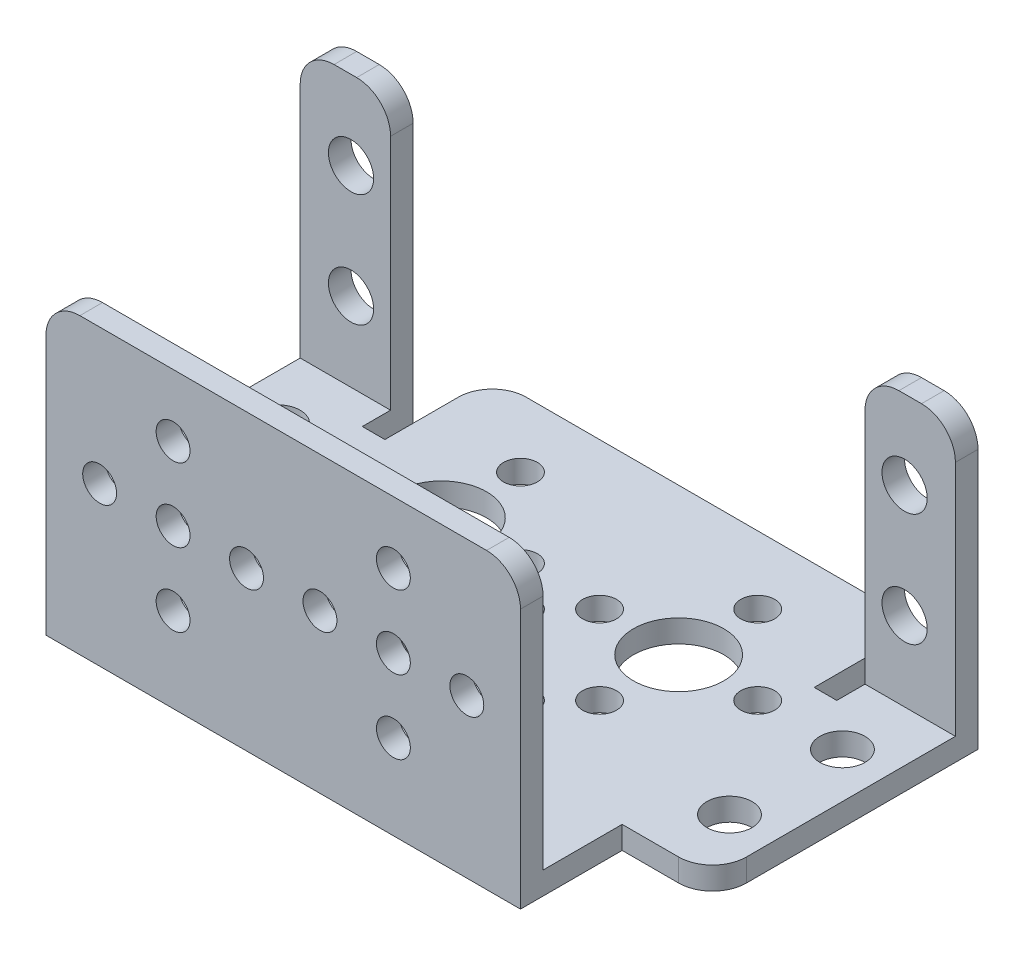
from build123d import *

# Parameters (mm, degrees)
SKETCH_1_R          = 2
SKETCH_1_R_2        = 4
SKETCH_1_R_3        = 1.5
EXTRUDE_1_DEPTH     = 2
SKETCH_2_W          = 42
SKETCH_2_H          = 2
SKETCH_2_W_2        = 8
EXTRUDE_2_DEPTH     = 26
SKETCH_3_R          = 2
SKETCH_3_R_2        = 1.5
CUT_EXTRUDE_1_DEPTH = 51.727211632
FILLET_1_R          = 3


with BuildPart() as part:
    # 草图1 → 凸台-拉伸1 (new body)
    with BuildSketch(Plane(origin=(0, 0, 0), x_dir=(1, 0, 0), z_dir=(0, 1, 0))):
        Polygon((-29, 7), (-21, 7), (-21, 0), (21, 0), (21, 7), (29, 7), (29, 28.5), (21, 28.5), (21, 26), (19, 26), (19, 35.5), (-19, 35.5), (-19, 26), (-21, 26), (-21, 28.5), (-29, 28.5), align=None)
        with Locations(Location((-25, 12.5, 0), (0, 0, 270))):
            Circle(SKETCH_1_R, mode=Mode.SUBTRACT)
        with Locations(Location((-25, 22.5, 0), (0, 0, 270))):
            Circle(SKETCH_1_R, mode=Mode.SUBTRACT)
        with Locations(Location((25, 22.5, 0), (0, 0, 90))):
            Circle(SKETCH_1_R, mode=Mode.SUBTRACT)
        with Locations(Location((25, 12.5, 0), (0, 0, 90))):
            Circle(SKETCH_1_R, mode=Mode.SUBTRACT)
        with Locations(Location((-10.5, 22.5, 0), (0, 0, 270))):
            Circle(SKETCH_1_R_2, mode=Mode.SUBTRACT)
        with Locations(Location((-10.5, 29.5, 0), (0, 0, 270))):
            Circle(SKETCH_1_R_3, mode=Mode.SUBTRACT)
        with Locations(Location((-3.5, 22.5, 0), (0, 0, 270))):
            Circle(SKETCH_1_R_3, mode=Mode.SUBTRACT)
        with Locations(Location((-10.5, 15.5, 0), (0, 0, 270))):
            Circle(SKETCH_1_R_3, mode=Mode.SUBTRACT)
        with Locations(Location((-17.5, 22.5, 0), (0, 0, 270))):
            Circle(SKETCH_1_R_3, mode=Mode.SUBTRACT)
        with Locations(Location((3.5, 22.5, 0), (0, 0, 90))):
            Circle(SKETCH_1_R_3, mode=Mode.SUBTRACT)
        with Locations(Location((10.5, 15.5, 0), (0, 0, 90))):
            Circle(SKETCH_1_R_3, mode=Mode.SUBTRACT)
        with Locations(Location((17.5, 22.5, 0), (0, 0, 90))):
            Circle(SKETCH_1_R_3, mode=Mode.SUBTRACT)
        with Locations(Location((10.5, 22.5, 0), (0, 0, 90))):
            Circle(SKETCH_1_R_2, mode=Mode.SUBTRACT)
        with Locations(Location((10.5, 29.5, 0), (0, 0, 90))):
            Circle(SKETCH_1_R_3, mode=Mode.SUBTRACT)
        with Locations(Location((0, 12, 0), (0, 0, 270))):
            Circle(SKETCH_1_R_2, mode=Mode.SUBTRACT)
        with Locations(Location((0, 19, 0), (0, 0, 270))):
            Circle(SKETCH_1_R_3, mode=Mode.SUBTRACT)
        with Locations(Location((7, 12, 0), (0, 0, 270))):
            Circle(SKETCH_1_R_3, mode=Mode.SUBTRACT)
        with Locations(Location((0, 5, 0), (0, 0, 270))):
            Circle(SKETCH_1_R_3, mode=Mode.SUBTRACT)
        with Locations(Location((-7, 12, 0), (0, 0, 270))):
            Circle(SKETCH_1_R_3, mode=Mode.SUBTRACT)
    extrude(amount=EXTRUDE_1_DEPTH)

    # 草图2 → 凸台-拉伸2 (add)
    with BuildSketch(Plane.XZ):
        with Locations((0, 1)):
            Rectangle(SKETCH_2_W, SKETCH_2_H)
        with Locations((-25, -29.5)):
            Rectangle(SKETCH_2_W_2, SKETCH_2_H)
        with Locations((25, -29.5)):
            Rectangle(SKETCH_2_W_2, SKETCH_2_H)
    extrude(amount=-EXTRUDE_2_DEPTH)

    # 草图3 → 切除-拉伸1 (cut, through all)
    with BuildSketch(Plane.XY.offset(-30.5)):
        with Locations(Location((-24.5, 19, 0), (0, 0, 180))):
            Circle(SKETCH_3_R)
        with Locations(Location((-24.5, 9, 0), (0, 0, 180))):
            Circle(SKETCH_3_R)
        with Locations(Location((24.5, 9, 0), (0, 0, 180))):
            Circle(SKETCH_3_R)
        with Locations(Location((24.5, 19, 0), (0, 0, 180))):
            Circle(SKETCH_3_R)
        with Locations((-16.25, 14)):
            Circle(SKETCH_3_R_2)
        with Locations((-9.75, 14)):
            Circle(SKETCH_3_R_2)
        with Locations((-3.25, 14)):
            Circle(SKETCH_3_R_2)
        with Locations((3.25, 14)):
            Circle(SKETCH_3_R_2)
        with Locations((9.75, 14)):
            Circle(SKETCH_3_R_2)
        with Locations((16.25, 14)):
            Circle(SKETCH_3_R_2)
        with Locations((-9.75, 7.5)):
            Circle(SKETCH_3_R_2)
        with Locations((-9.75, 20.5)):
            Circle(SKETCH_3_R_2)
        with Locations(Location((9.75, 7.5, 0), (0, 0, 180))):
            Circle(SKETCH_3_R_2)
        with Locations(Location((9.75, 20.5, 0), (0, 0, 180))):
            Circle(SKETCH_3_R_2)
    extrude(amount=CUT_EXTRUDE_1_DEPTH, mode=Mode.SUBTRACT)

    # 圆角1
    fillet_1_edges = [part.edges().sort_by_distance(p)[0] for p in [
        (-21, 26, 1),
        (21, 26, 1),
        (-21, 26, -29.5),
        (-29, 26, -29.5),
        (29, 26, -29.5),
        (21, 26, -29.5),
        (-19, 1, -35.5),
        (19, 1, -35.5),
        (29, 1, -7),
        (-29, 1, -7),
    ]]
    fillet(fillet_1_edges, radius=FILLET_1_R)


solid = part.part
